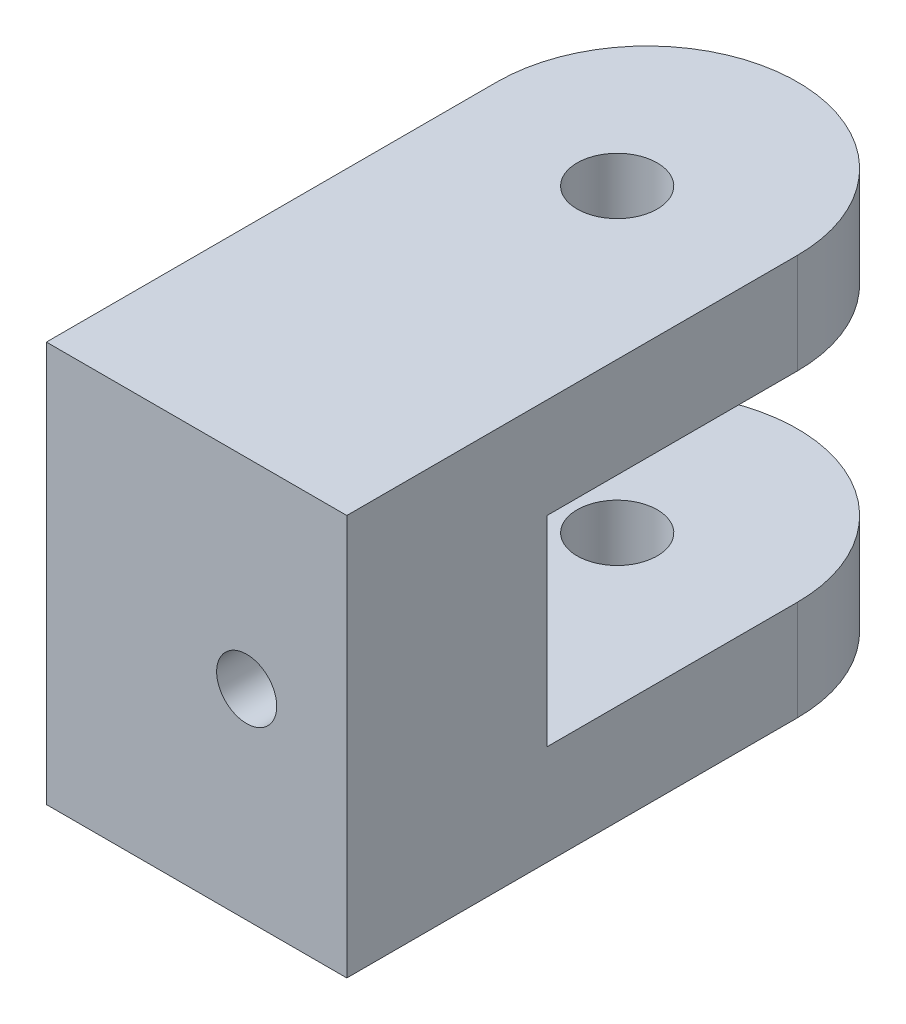
from build123d import *

# Parameters (mm, degrees)
SKETCH_1_W          = 15
SKETCH_1_H          = 20
EXTRUDE_1_DEPTH     = 10
SKETCH_2_W          = 15
SKETCH_2_H          = 20
SKETCH_2_R          = 2
EXTRUDE_2_DEPTH     = 20
SKETCH_3_W          = 20
SKETCH_3_H          = 10
CUT_EXTRUDE_1_DEPTH = 33.015621187
FILLET_1_RADIUS     = 7.5
FILLET_1_LENGTH     = 5
FILLET_2_RADIUS     = 7.5
FILLET_2_LENGTH     = 5
SKETCH_4_R          = 1.5
CUT_EXTRUDE_2_DEPTH = 40.05124838


with BuildPart() as part:
    # 草图1 → 凸台-拉伸1 (new body)
    with BuildSketch(Plane.XY):
        with Locations((7.5, 10)):
            Rectangle(SKETCH_1_W, SKETCH_1_H)
    extrude(amount=EXTRUDE_1_DEPTH)

    # 草图2 → 凸台-拉伸2 (add)
    with BuildSketch(Plane.XZ):
        with Locations((7.5, -10)):
            Rectangle(SKETCH_2_W, SKETCH_2_H)
        with Locations(Location((7.5, -11, 0), (0, 0, 270))):
            Circle(SKETCH_2_R, mode=Mode.SUBTRACT)
    extrude(amount=-EXTRUDE_2_DEPTH)

    # 草图3 → 切除-拉伸1 (cut, through all)
    with BuildSketch(Plane(origin=(15, 0, 0), x_dir=(0, 0, -1), z_dir=(1, 0, 0))):
        with Locations((10, 10)):
            Rectangle(SKETCH_3_W, SKETCH_3_H)
    extrude(amount=-CUT_EXTRUDE_1_DEPTH, mode=Mode.SUBTRACT)

    # 圆角1: full round fillet: the end face becomes a half cylinder, R = half its width
    fillet_1_face = Plane((7.5, 17.5, -20), x_dir=(0, 1, 0), z_dir=(0, 0, -1))  # on the end face: x along it, z out of the body
    fillet_1_slab = fillet_1_face.offset(-FILLET_1_RADIUS / 2) * Box(FILLET_1_LENGTH, 2 * FILLET_1_RADIUS, FILLET_1_RADIUS, mode=Mode.PRIVATE)  # the body's end, R deep
    fillet_1_round = Plane((7.5, 17.5, -12.5), x_dir=(0, 0, -1), z_dir=(0, 1, 0)) * Cylinder(FILLET_1_RADIUS, FILLET_1_LENGTH, mode=Mode.PRIVATE)  # its axis R under the face
    add(fillet_1_slab - fillet_1_round, mode=Mode.SUBTRACT)

    # 圆角2: full round fillet: the end face becomes a half cylinder, R = half its width
    fillet_2_face = Plane((7.5, 2.5, -20), x_dir=(0, -1, 0), z_dir=(0, 0, -1))  # on the end face: x along it, z out of the body
    fillet_2_slab = fillet_2_face.offset(-FILLET_2_RADIUS / 2) * Box(FILLET_2_LENGTH, 2 * FILLET_2_RADIUS, FILLET_2_RADIUS, mode=Mode.PRIVATE)  # the body's end, R deep
    fillet_2_round = Plane((7.5, 2.5, -12.5), x_dir=(0, 0, -1), z_dir=(0, -1, 0)) * Cylinder(FILLET_2_RADIUS, FILLET_2_LENGTH, mode=Mode.PRIVATE)  # its axis R under the face
    add(fillet_2_slab - fillet_2_round, mode=Mode.SUBTRACT)

    # 草图4 → 切除-拉伸2 (cut, through all)
    with BuildSketch(Plane.XY.offset(10)):
        with Locations((10, 10)):
            Circle(SKETCH_4_R)
    extrude(amount=-CUT_EXTRUDE_2_DEPTH, mode=Mode.SUBTRACT)


solid = part.part
